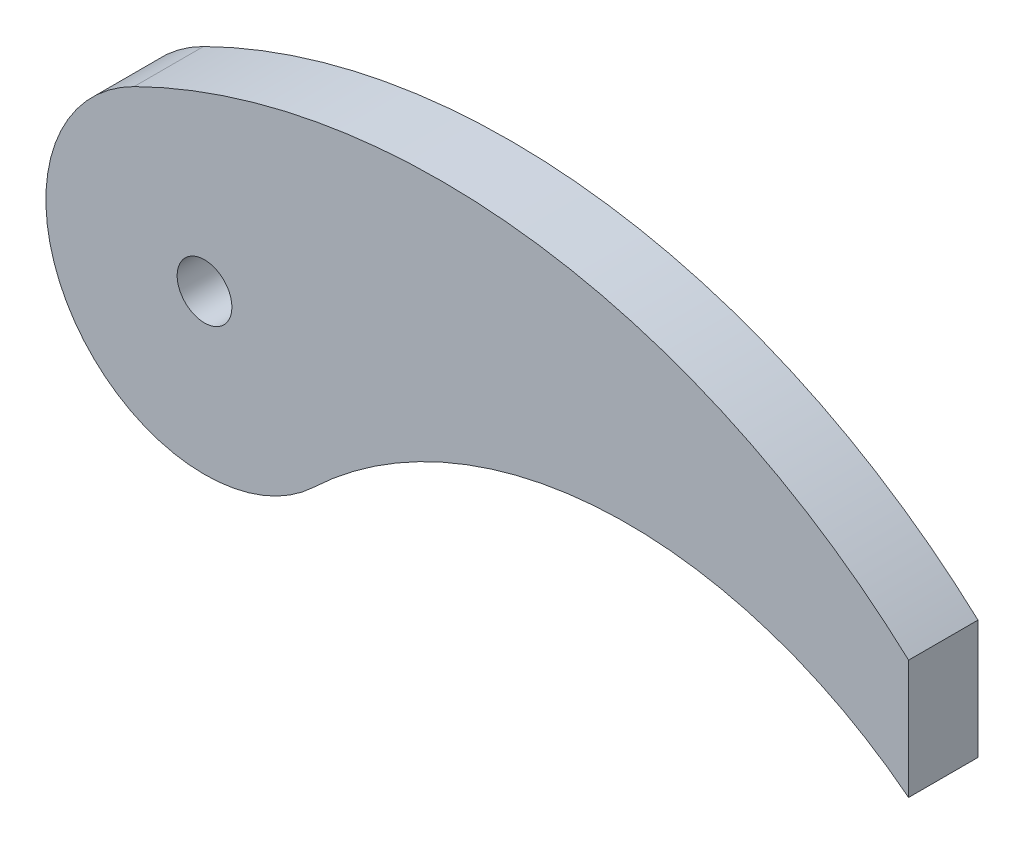
from build123d import *

# Parameters (mm, degrees)
SKETCH1_R           = 1.7526
BOSS_EXTRUDE1_DEPTH = 4.445


with BuildPart() as part:
    # Sketch1 → Boss-Extrude1 (new body)
    with BuildSketch(Plane.XY):
        with BuildLine():
            Line((45.097053324, -5.527793834), (45.097053324, 2.092206166))
            ThreePointArc((45.097053324, 2.092206166), (21.378517637, 13.276466986), (-4.510590735, 9.103854745))
            ThreePointArc((-4.510590735, 9.103854745), (-8.328542576, -5.819018694), (6.997053324, -7.366603341))
            ThreePointArc((6.997053324, -7.366603341), (25.705466674, 0.630452091), (45.097053324, -5.527793834))
        make_face()
        Circle(SKETCH1_R, mode=Mode.SUBTRACT)
    extrude(amount=BOSS_EXTRUDE1_DEPTH)


solid = part.part
